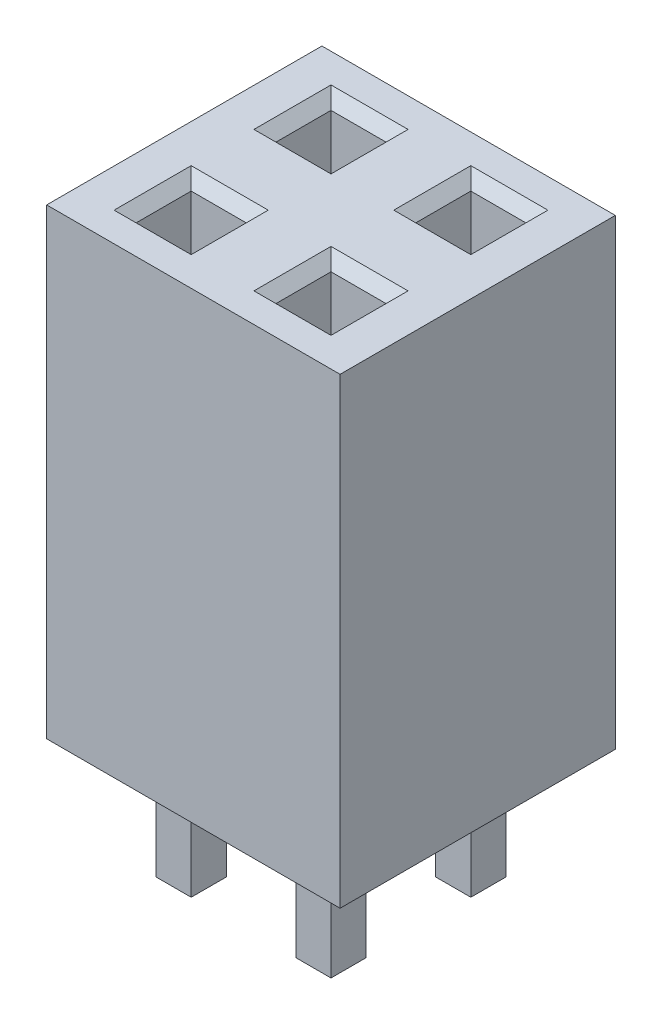
from build123d import *

# Parameters (mm, degrees)
SKETCH_1_W                         = 2.79
SKETCH_1_H                         = 5
EXTRUDE_1_DEPTH                    = 8.4
SKETCH_2_W                         = 1
SKETCH_2_H                         = 1
CUT_EXTRUDE_1_DEPTH                = 8
CHAMFER_1_SIZE                     = 0.2
SKETCH_3_W                         = 0.64
SKETCH_3_H                         = 0.64
EXTRUDE_2_DEPTH                    = 2.29
CHAMFER_2_SIZE                     = 0.2
PATTERN_LINEAR_1_COUNT             = 2
PATTERN_LINEAR_1_PITCH             = 2.54
CHAMFER_1_OF_PATTERN_LINEAR_1_SIZE = 0.2
CHAMFER_2_OF_PATTERN_LINEAR_1_SIZE = 0.2


with BuildPart() as part:
    # Эскиз1 → Бобышка-Вытянуть1 (new body)
    with BuildSketch(Plane(origin=(0, 0, 0), x_dir=(1, 0, 0), z_dir=(0, 1, 0))):
        Rectangle(SKETCH_1_W, SKETCH_1_H)
    extrude_1 = extrude(amount=EXTRUDE_1_DEPTH)

    # Эскиз2 → Вырез-Вытянуть1 (cut)
    with BuildSketch(Plane(origin=(0, 8.4, 0), x_dir=(1, 0, 0), z_dir=(0, 1, 0))):
        with Locations((0, 1.27)):
            Rectangle(SKETCH_2_W, SKETCH_2_H)
        with Locations((0, -1.27)):
            Rectangle(SKETCH_2_W, SKETCH_2_H)
    cut_extrude_1 = extrude(amount=-CUT_EXTRUDE_1_DEPTH, mode=Mode.SUBTRACT)

    # Фаска1
    chamfer_1_edges = [part.edges().sort_by_distance(p)[0] for p in [
        (0.5, 8.4, -1.27),
        (0, 8.4, -1.77),
        (-0.5, 8.4, -1.27),
        (0, 8.4, -0.77),
        (0, 8.4, 1.77),
        (0.5, 8.4, 1.27),
        (0, 8.4, 0.77),
        (-0.5, 8.4, 1.27),
    ]]
    chamfer(chamfer_1_edges, length=CHAMFER_1_SIZE)

    # Эскиз3 → Бобышка-Вытянуть2 (add)
    with BuildSketch(Plane(origin=(0, 0, 0), x_dir=(-1, 0, 0), z_dir=(0, -1, 0))):
        with Locations((0, 1.27)):
            Rectangle(SKETCH_3_W, SKETCH_3_H)
        with Locations((0, -1.27)):
            Rectangle(SKETCH_3_W, SKETCH_3_H)
    extrude_2 = extrude(amount=EXTRUDE_2_DEPTH)

    # Фаска2
    chamfer_2_edges = [part.edges().sort_by_distance(p)[0] for p in [
        (0.32, -2.29, -1.27),
        (0, -2.29, -0.95),
        (-0.32, -2.29, -1.27),
        (0, -2.29, -1.59),
        (-0.32, -2.29, 1.27),
        (0, -2.29, 0.95),
        (0.32, -2.29, 1.27),
        (0, -2.29, 1.59),
    ]]
    chamfer(chamfer_2_edges, length=CHAMFER_2_SIZE)

    # Линейный массив1: Бобышка-Вытянуть1, Вырез-Вытянуть1, Бобышка-Вытянуть2 ×2
    with Locations(*[(i * PATTERN_LINEAR_1_PITCH, 0, 0) for i in range(1, PATTERN_LINEAR_1_COUNT)]):
        add(extrude_1)
        add(cut_extrude_1, mode=Mode.SUBTRACT)
        add(extrude_2)

    # Фаска1 of Линейный массив1
    chamfer_1_of_pattern_linear_1_edges = [part.edges().sort_by_distance(p)[0] for p in [
        (3.04, 8.4, -1.27),
        (2.54, 8.4, -1.77),
        (2.04, 8.4, -1.27),
        (2.54, 8.4, -0.77),
        (2.54, 8.4, 1.77),
        (3.04, 8.4, 1.27),
        (2.54, 8.4, 0.77),
        (2.04, 8.4, 1.27),
    ]]
    chamfer(chamfer_1_of_pattern_linear_1_edges, length=CHAMFER_1_OF_PATTERN_LINEAR_1_SIZE)

    # Фаска2 of Линейный массив1
    chamfer_2_of_pattern_linear_1_edges = [part.edges().sort_by_distance(p)[0] for p in [
        (2.86, -2.29, -1.27),
        (2.54, -2.29, -0.95),
        (2.22, -2.29, -1.27),
        (2.54, -2.29, -1.59),
        (2.22, -2.29, 1.27),
        (2.54, -2.29, 0.95),
        (2.86, -2.29, 1.27),
        (2.54, -2.29, 1.59),
    ]]
    chamfer(chamfer_2_of_pattern_linear_1_edges, length=CHAMFER_2_OF_PATTERN_LINEAR_1_SIZE)


solid = part.part
